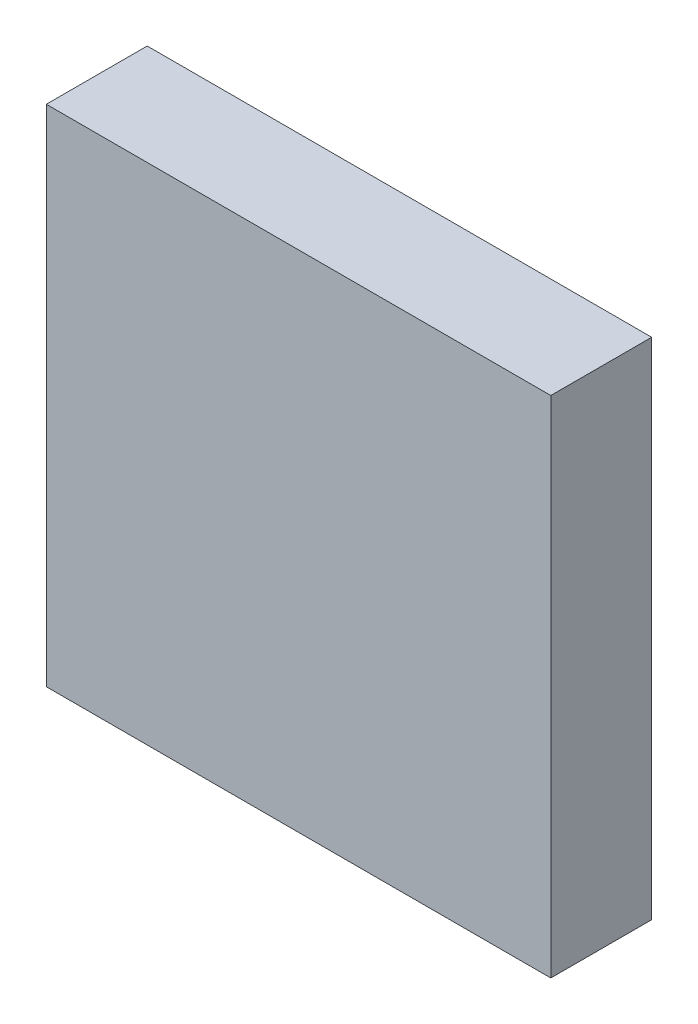
from build123d import *

# Parameters (mm, degrees)
SKETCH_1_W      = 20
SKETCH_1_H      = 20
EXTRUDE_1_DEPTH = 4


with BuildPart() as part:
    # Эскиз1 → Бобышка-Вытянуть1 (new body)
    with BuildSketch(Plane.XY):
        with Locations((-10, -10)):
            Rectangle(SKETCH_1_W, SKETCH_1_H)
    extrude(amount=EXTRUDE_1_DEPTH)


solid = part.part
